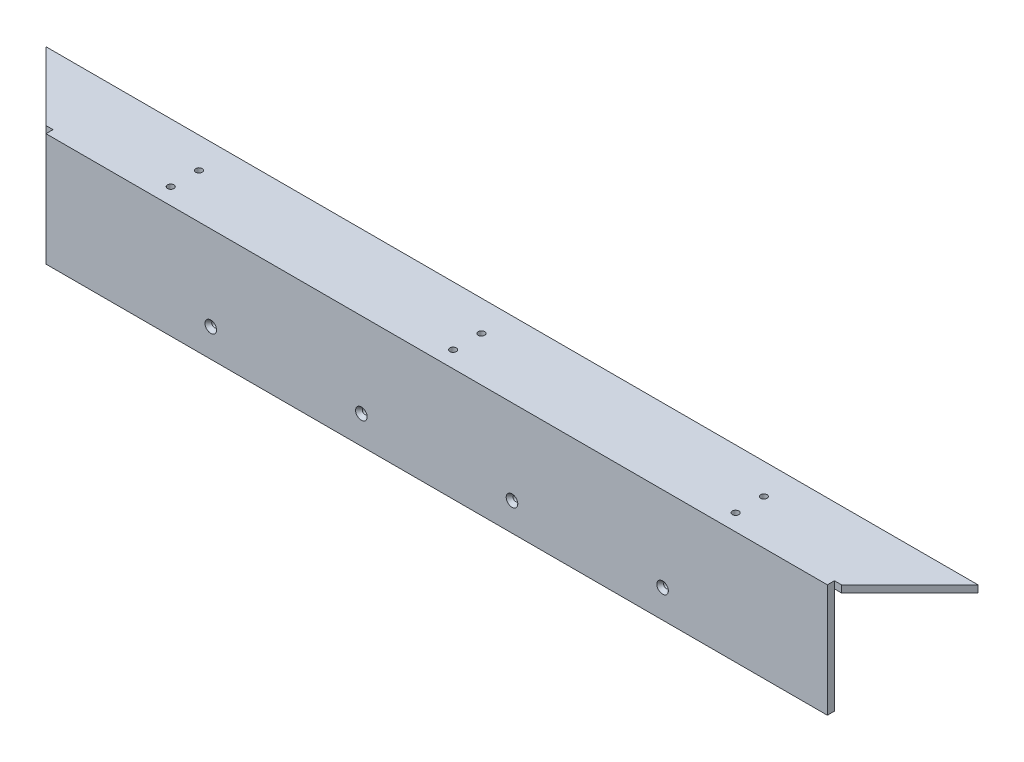
from build123d import *

# Parameters (mm, degrees)
SKETCH3_W                                        = 1073.15
SKETCH3_H                                        = 1073.15
BOSS_EXTRUDE1_DEPTH                              = 152.4
SKETCH4_OUTSIDE_W                                = 1380.21
SKETCH4_OUTSIDE_H                                = 1380.21
SKETCH4_OUTSIDE_W_2                              = 1073.15
SKETCH4_OUTSIDE_H_2                              = 1073.15
SKETCH4_OUTSIDE_W_3                              = 1054.1
SKETCH4_OUTSIDE_H_3                              = 1054.1
CUT_EXTRUDE3_DEPTH                               = 142.875
SKETCH5_W                                        = 1358.9
SKETCH5_H                                        = 1358.9
SKETCH5_W_2                                      = 1073.15
SKETCH5_H_2                                      = 1073.15
BOSS_EXTRUDE2_DEPTH                              = 9.525
SKETCH6_W                                        = 1054.1
SKETCH6_H                                        = 1054.1
CUT_EXTRUDE5_DEPTH                               = 9.525
SKETCH7_R                                        = 4.365625
SKETCH7_R_2                                      = 4.36499
CUT_EXTRUDE6_DEPTH                               = 9.525
SKETCH8_R                                        = 2.50063
CUT_EXTRUDE7_DEPTH                               = 1270
SKETCH9_R                                        = 2.50063
CUT_EXTRUDE8_DEPTH                               = 1270
SKETCH10_R                                       = 3.5687
CUT_EXTRUDE10_DEPTH                              = 1270
SKETCH11_W                                       = 1358.9
SKETCH11_H                                       = 1358.9
SKETCH11_W_2                                     = 1206.5
SKETCH11_H_2                                     = 1206.5
CUT_EXTRUDE11_DEPTH                              = 9.525
CUT_EXTRUDE12_DEPTH                              = 254
CUT_EXTRUDE13_DEPTH                              = 867.629612349
CSK_FOR_1_4_FLAT_HEAD_MACHINE_SCREW1_D           = 7.1374
CSK_FOR_1_4_FLAT_HEAD_MACHINE_SCREW1_CSINK_D     = 15.637764
CSK_FOR_1_4_FLAT_HEAD_MACHINE_SCREW1_CSINK_ANGLE = 82
CSK_FOR_1_4_FLAT_HEAD_MACHINE_SCREW2_D           = 7.1374
CSK_FOR_1_4_FLAT_HEAD_MACHINE_SCREW2_CSINK_D     = 15.637764
CSK_FOR_1_4_FLAT_HEAD_MACHINE_SCREW2_CSINK_ANGLE = 82
CSK_FOR_1_4_FLAT_HEAD_MACHINE_SCREW3_D           = 7.1374
CSK_FOR_1_4_FLAT_HEAD_MACHINE_SCREW3_CSINK_D     = 15.637764
CSK_FOR_1_4_FLAT_HEAD_MACHINE_SCREW3_CSINK_ANGLE = 82
CSK_FOR_1_4_FLAT_HEAD_MACHINE_SCREW5_D           = 7.1374
CSK_FOR_1_4_FLAT_HEAD_MACHINE_SCREW5_CSINK_D     = 15.5273756
CSK_FOR_1_4_FLAT_HEAD_MACHINE_SCREW5_CSINK_ANGLE = 82
BOSS_EXTRUDE3_DEPTH                              = 9.525


with BuildPart() as part:
    # Sketch3 → Boss-Extrude1 (new body)
    with BuildSketch(Plane(origin=(0, 0, 0), x_dir=(1, 0, 0), z_dir=(0, 1, 0))):
        Rectangle(SKETCH3_W, SKETCH3_H)
    extrude(amount=BOSS_EXTRUDE1_DEPTH)

    # Sketch4 outside → Cut-Extrude3 (cut)
    # profile 1 of 2: a face of its own
    with BuildSketch(Plane(origin=(0, 152.4, 0), x_dir=(1, 0, 0), z_dir=(0, 1, 0))):
        Rectangle(SKETCH4_OUTSIDE_W, SKETCH4_OUTSIDE_H)
        Rectangle(SKETCH4_OUTSIDE_W_2, SKETCH4_OUTSIDE_H_2, mode=Mode.SUBTRACT)
    # profile 2 of 2: a face of its own
    with BuildSketch(Plane(origin=(0, 152.4, 0), x_dir=(1, 0, 0), z_dir=(0, 1, 0))):
        Rectangle(SKETCH4_OUTSIDE_W_3, SKETCH4_OUTSIDE_H_3)
    extrude(amount=-CUT_EXTRUDE3_DEPTH, mode=Mode.SUBTRACT)

    # Sketch5 → Boss-Extrude2 (add)
    with BuildSketch(Plane(origin=(0, 152.4, 0), x_dir=(1, 0, 0), z_dir=(0, 1, 0))):
        Rectangle(SKETCH5_W, SKETCH5_H)
        Rectangle(SKETCH5_W_2, SKETCH5_H_2, mode=Mode.SUBTRACT)
    extrude(amount=-BOSS_EXTRUDE2_DEPTH)

    # Sketch6 → Cut-Extrude5 (cut)
    with BuildSketch(Plane(origin=(0, 9.525, 0), x_dir=(1, 0, 0), z_dir=(0, 1, 0))):
        Rectangle(SKETCH6_W, SKETCH6_H)
    extrude(amount=-CUT_EXTRUDE5_DEPTH, mode=Mode.SUBTRACT)

    # Sketch7 → Cut-Extrude6 (cut)
    with BuildSketch(Plane(origin=(0, 152.4, 0), x_dir=(1, 0, 0), z_dir=(0, 1, 0))):
        with Locations(Location((549.275, 38.1, 0), (0, 0, 270))):
            Circle(SKETCH7_R)
        with Locations(Location((587.375, -38.1, 0), (0, 0, 270))):
            Circle(SKETCH7_R)
        with Locations(Location((549.275, -38.1, 0), (0, 0, 270))):
            Circle(SKETCH7_R)
        with Locations(Location((587.375, 38.1, 0), (0, 0, 270))):
            Circle(SKETCH7_R)
        with Locations(Location((549.275, 419.1, 0), (0, 0, 270))):
            Circle(SKETCH7_R)
        with Locations(Location((549.275, 342.9, 0), (0, 0, 270))):
            Circle(SKETCH7_R)
        with Locations(Location((587.375, 342.9, 0), (0, 0, 270))):
            Circle(SKETCH7_R)
        with Locations(Location((587.375, 419.1, 0), (0, 0, 270))):
            Circle(SKETCH7_R)
        with Locations(Location((587.375, -419.1, 0), (0, 0, 270))):
            Circle(SKETCH7_R)
        with Locations(Location((549.275, -419.1, 0), (0, 0, 270))):
            Circle(SKETCH7_R)
        with Locations(Location((587.375, -342.9, 0), (0, 0, 270))):
            Circle(SKETCH7_R)
        with Locations(Location((549.275, -342.9, 0), (0, 0, 270))):
            Circle(SKETCH7_R)
        with Locations(Location((-549.275, -38.1, 0), (0, 0, 270))):
            Circle(SKETCH7_R)
        with Locations(Location((-549.275, 419.1, 0), (0, 0, 270))):
            Circle(SKETCH7_R)
        with Locations(Location((-549.275, 342.9, 0), (0, 0, 270))):
            Circle(SKETCH7_R)
        with Locations(Location((-549.275, -342.9, 0), (0, 0, 270))):
            Circle(SKETCH7_R)
        with Locations(Location((-549.275, 38.1, 0), (0, 0, 270))):
            Circle(SKETCH7_R)
        with Locations(Location((-549.275, -419.1, 0), (0, 0, 270))):
            Circle(SKETCH7_R)
        with Locations(Location((-342.9, -549.275, 0), (0, 0, 270))):
            Circle(SKETCH7_R)
        with Locations(Location((-38.1, -549.275, 0), (0, 0, 270))):
            Circle(SKETCH7_R)
        with Locations(Location((419.1, -549.275, 0), (0, 0, 270))):
            Circle(SKETCH7_R)
        with Locations(Location((342.9, -549.275, 0), (0, 0, 270))):
            Circle(SKETCH7_R)
        with Locations(Location((38.1, -549.275, 0), (0, 0, 270))):
            Circle(SKETCH7_R)
        with Locations(Location((-419.1, -549.275, 0), (0, 0, 270))):
            Circle(SKETCH7_R)
        with Locations(Location((-584.2, -342.9, 0), (0, 0, 270))):
            Circle(SKETCH7_R)
        with Locations(Location((-584.2, -419.1, 0), (0, 0, 270))):
            Circle(SKETCH7_R)
        with Locations(Location((-584.2, 342.9, 0), (0, 0, 270))):
            Circle(SKETCH7_R)
        with Locations(Location((-584.2, -38.1, 0), (0, 0, 270))):
            Circle(SKETCH7_R)
        with Locations(Location((-584.2, 419.1, 0), (0, 0, 270))):
            Circle(SKETCH7_R)
        with Locations(Location((-584.2, 38.1, 0), (0, 0, 270))):
            Circle(SKETCH7_R)
        with Locations(Location((-342.9, -584.2, 0), (0, 0, 270))):
            Circle(SKETCH7_R)
        with Locations(Location((-419.1, -584.2, 0), (0, 0, 270))):
            Circle(SKETCH7_R)
        with Locations(Location((38.1, -584.2, 0), (0, 0, 270))):
            Circle(SKETCH7_R)
        with Locations(Location((419.1, -584.2, 0), (0, 0, 270))):
            Circle(SKETCH7_R)
        with Locations(Location((-38.1, -584.2, 0), (0, 0, 270))):
            Circle(SKETCH7_R)
        with Locations(Location((342.9, -584.2, 0), (0, 0, 270))):
            Circle(SKETCH7_R)
        with Locations(Location((-381, 587.375, 0), (0, 0, 270))):
            Circle(SKETCH7_R_2)
        with Locations(Location((-381, 549.275, 0), (0, 0, 270))):
            Circle(SKETCH7_R_2)
        with Locations(Location((0, 587.375, 0), (0, 0, 270))):
            Circle(SKETCH7_R_2)
        with Locations(Location((0, 549.275, 0), (0, 0, 270))):
            Circle(SKETCH7_R_2)
        with Locations(Location((381, 587.375, 0), (0, 0, 270))):
            Circle(SKETCH7_R_2)
        with Locations(Location((381, 549.275, 0), (0, 0, 270))):
            Circle(SKETCH7_R_2)
    extrude(amount=-CUT_EXTRUDE6_DEPTH, mode=Mode.SUBTRACT)

    # Sketch8 → Cut-Extrude7 (cut)
    with BuildSketch(Plane.ZY.offset(536.575)):
        with Locations((371.475, 38.1)):
            Circle(SKETCH8_R)
    extrude(amount=-CUT_EXTRUDE7_DEPTH, mode=Mode.SUBTRACT)

    # Sketch9 → Cut-Extrude8 (cut)
    with BuildSketch(Plane.ZY.offset(536.575)):
        with Locations((-371.475, 38.1)):
            Circle(SKETCH9_R)
        with Locations((-222.885, 38.1)):
            Circle(SKETCH9_R)
        with Locations((-74.295, 38.1)):
            Circle(SKETCH9_R)
        with Locations((74.295, 38.1)):
            Circle(SKETCH9_R)
        with Locations((222.885, 38.1)):
            Circle(SKETCH9_R)
    extrude(amount=-CUT_EXTRUDE8_DEPTH, mode=Mode.SUBTRACT)

    # Sketch10 → Cut-Extrude10 (cut)
    with BuildSketch(Plane.XY.offset(536.575)):
        with Locations((-304.8, 38.1)):
            Circle(SKETCH10_R)
        with Locations((-101.6, 38.1)):
            Circle(SKETCH10_R)
        with Locations((101.6, 38.1)):
            Circle(SKETCH10_R)
        with Locations((304.8, 38.1)):
            Circle(SKETCH10_R)
    extrude(amount=-CUT_EXTRUDE10_DEPTH, mode=Mode.SUBTRACT)

    # Sketch11 → Cut-Extrude11 (cut)
    with BuildSketch(Plane(origin=(0, 152.4, 0), x_dir=(1, 0, 0), z_dir=(0, 1, 0))):
        Rectangle(SKETCH11_W, SKETCH11_H)
        Rectangle(SKETCH11_W_2, SKETCH11_H_2, mode=Mode.SUBTRACT)
    extrude(amount=-CUT_EXTRUDE11_DEPTH, mode=Mode.SUBTRACT)

    # Sketch12 → Cut-Extrude12 (cut)
    with BuildSketch(Plane(origin=(0, 152.4, 0), x_dir=(1, 0, 0), z_dir=(0, 1, 0))):
        Polygon((-527.05, 527.05), (-527.05, -527.05), (527.05, -527.05), (527.05, 527.05), (603.25, 603.25), (603.25, -603.25), (-603.25, -603.25), (-603.25, 603.25), align=None)
    extrude(amount=-CUT_EXTRUDE12_DEPTH, mode=Mode.SUBTRACT)

    # Sketch14 → Cut-Extrude13 (cut, through all)
    with BuildSketch(Plane.XZ):
        Polygon((-527.05, -527.05), (-536.575, -536.575), (-527.05, -536.575), align=None)
        Polygon((536.575, -536.575), (527.05, -536.575), (527.05, -527.05), align=None)
    extrude(amount=-CUT_EXTRUDE13_DEPTH, mode=Mode.SUBTRACT)

    # CSK for 1/4 Flat Head Machine Screw1 (through all)
    with Locations(Plane(origin=(-304.8, 38.1, -527.05), x_dir=(1, 0, 0), z_dir=(0, 0, 1))):
        with Locations((0, 0)):
            CounterSinkHole(CSK_FOR_1_4_FLAT_HEAD_MACHINE_SCREW1_D / 2, CSK_FOR_1_4_FLAT_HEAD_MACHINE_SCREW1_CSINK_D / 2, counter_sink_angle=CSK_FOR_1_4_FLAT_HEAD_MACHINE_SCREW1_CSINK_ANGLE)

    # CSK for 1/4 Flat Head Machine Screw2 (through all)
    with Locations(Plane(origin=(-101.6, 38.1, -527.05), x_dir=(1, 0, 0), z_dir=(0, 0, 1))):
        with Locations((0, 0)):
            CounterSinkHole(CSK_FOR_1_4_FLAT_HEAD_MACHINE_SCREW2_D / 2, CSK_FOR_1_4_FLAT_HEAD_MACHINE_SCREW2_CSINK_D / 2, counter_sink_angle=CSK_FOR_1_4_FLAT_HEAD_MACHINE_SCREW2_CSINK_ANGLE)

    # CSK for 1/4 Flat Head Machine Screw3 (through all)
    with Locations(Plane(origin=(101.6, 38.1, -527.05), x_dir=(1, 0, 0), z_dir=(0, 0, 1))):
        with Locations((0, 0)):
            CounterSinkHole(CSK_FOR_1_4_FLAT_HEAD_MACHINE_SCREW3_D / 2, CSK_FOR_1_4_FLAT_HEAD_MACHINE_SCREW3_CSINK_D / 2, counter_sink_angle=CSK_FOR_1_4_FLAT_HEAD_MACHINE_SCREW3_CSINK_ANGLE)

    # CSK for 1/4 Flat Head Machine Screw5 (through all)
    with Locations(Plane(origin=(304.8, 38.1, -527.05), x_dir=(1, 0, 0), z_dir=(0, 0, 1))):
        with Locations((0, 0)):
            CounterSinkHole(CSK_FOR_1_4_FLAT_HEAD_MACHINE_SCREW5_D / 2, CSK_FOR_1_4_FLAT_HEAD_MACHINE_SCREW5_CSINK_D / 2, counter_sink_angle=CSK_FOR_1_4_FLAT_HEAD_MACHINE_SCREW5_CSINK_ANGLE)

    # Sketch22 → Boss-Extrude3 (add)
    with BuildSketch(Plane(origin=(0, 152.4, 0), x_dir=(1, 0, 0), z_dir=(0, 1, 0))):
        Polygon((603.25, 603.25), (-603.25, 603.25), (-628.65, 628.65), (628.65, 628.65), align=None)
    extrude(amount=-BOSS_EXTRUDE3_DEPTH)


solid = part.part
